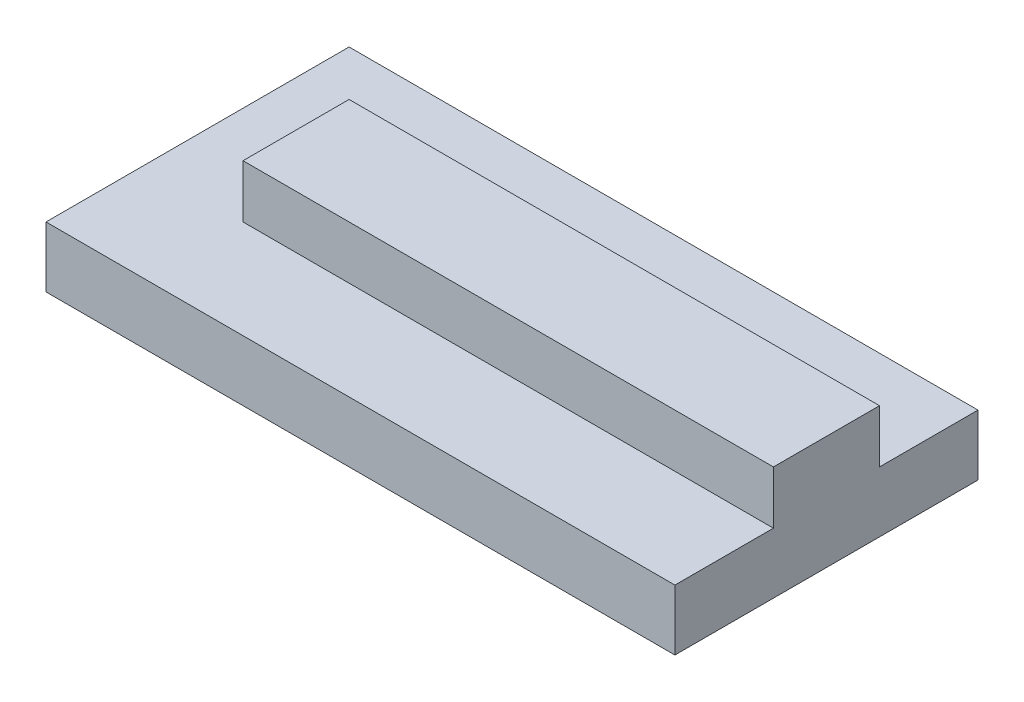
from build123d import *

# Parameters (mm, degrees)
SKETCH1_W           = 41.5
SKETCH1_H           = 20
BOSS_EXTRUDE1_DEPTH = 4
SKETCH2_W           = 35
SKETCH2_H           = 7
BOSS_EXTRUDE2_DEPTH = 3.5


with BuildPart() as part:
    # Sketch1 → Boss-Extrude1 (new body)
    with BuildSketch(Plane(origin=(0, 0, 0), x_dir=(1, 0, 0), z_dir=(0, 1, 0))):
        with Locations((20.75, 10)):
            Rectangle(SKETCH1_W, SKETCH1_H)
    extrude(amount=BOSS_EXTRUDE1_DEPTH)

    # Sketch2 → Boss-Extrude2 (add)
    with BuildSketch(Plane(origin=(0, 4, 0), x_dir=(1, 0, 0), z_dir=(0, 1, 0))):
        with Locations((24, 10)):
            Rectangle(SKETCH2_W, SKETCH2_H)
    extrude(amount=BOSS_EXTRUDE2_DEPTH)


solid = part.part
